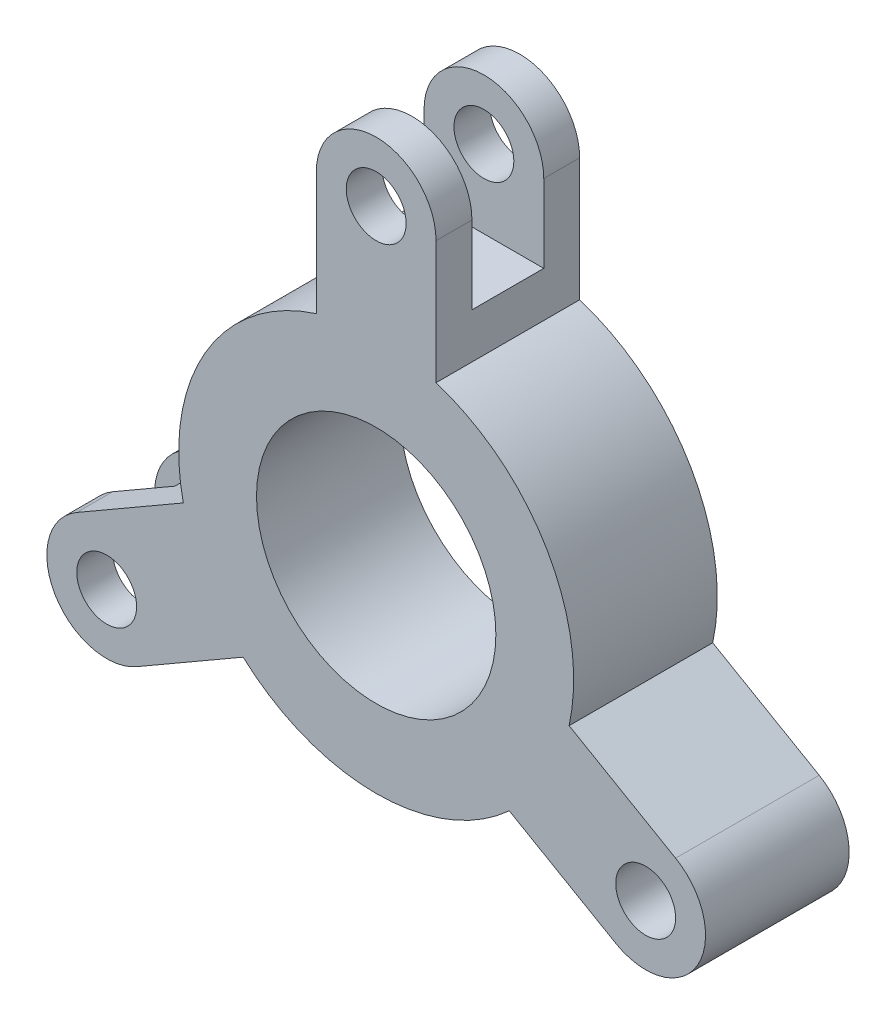
from build123d import *

# Parameters (mm, degrees)
EXTRUDE_1_DEPTH          = 6
EXTRUDE_1_DEPTH_BACK     = 6
SKETCH_1_R               = 2.5
CUT_EXTRUDE_1_DEPTH      = 3
CUT_EXTRUDE_1_DEPTH_BACK = 3
SKETCH_2_W               = 15
SKETCH_2_H               = 13
CUT_EXTRUDE_2_DEPTH      = 6


with BuildPart() as part:
    # Эскиз1 → Бобышка-Вытянуть1 (new, two sides: drawn at the far end of the back side and taken through both)
    # profile 1 of 9: a face of its own
    with BuildSketch(Plane.XY.offset(-EXTRUDE_1_DEPTH_BACK)):
        with BuildLine():
            Line((5, 15.724185194), (5, 8.660254038))
            ThreePointArc((5, 8.660254038), (8.660254038, 5), (10, 0))
            Line((10, 0), (16.117543831, -3.531965578))
            ThreePointArc((16.117543831, -3.531965578), (16.404107309, -1.776306108), (16.5, 0))
            ThreePointArc((16.5, 0), (13.318220602, 9.740379869), (5, 15.724185194))
        make_face()
    # profile 2 of 9: a face of its own
    with BuildSketch(Plane.XY.offset(-EXTRUDE_1_DEPTH_BACK)):
        with BuildLine():
            Line((-5, 15.724185194), (-5, 8.660254038))
            ThreePointArc((-5, 8.660254038), (0, 10), (5, 8.660254038))
            Line((5, 8.660254038), (5, 15.724185194))
            ThreePointArc((5, 15.724185194), (0, 16.5), (-5, 15.724185194))
        make_face()
    # profile 3 of 9: a face of its own
    with BuildSketch(Plane.XY.offset(-EXTRUDE_1_DEPTH_BACK)):
        with BuildLine():
            ThreePointArc((-10, 0), (-8.660254038, 5), (-5, 8.660254038))
            Line((-5, 8.660254038), (-5, 15.724185194))
            ThreePointArc((-5, 15.724185194), (-14.289419162, 8.25), (-16.117543831, -3.531965578))
            Line((-16.117543831, -3.531965578), (-10, 0))
        make_face()
    # profile 4 of 9: a face of its own
    with BuildSketch(Plane.XY.offset(-EXTRUDE_1_DEPTH_BACK)):
        with BuildLine():
            ThreePointArc((-5, -8.660254038), (-8.660254038, -5), (-10, 0))
            Line((-10, 0), (-16.117543831, -3.531965578))
            ThreePointArc((-16.117543831, -3.531965578), (-14.289419162, -8.25), (-11.117543831, -12.192219616))
            Line((-11.117543831, -12.192219616), (-5, -8.660254038))
        make_face()
    # profile 5 of 9: a face of its own
    with BuildSketch(Plane.XY.offset(-EXTRUDE_1_DEPTH_BACK)):
        with BuildLine():
            ThreePointArc((5, -8.660254038), (0, -10), (-5, -8.660254038))
            Line((-5, -8.660254038), (-11.117543831, -12.192219616))
            ThreePointArc((-11.117543831, -12.192219616), (0, -16.5), (11.117543831, -12.192219616))
            Line((11.117543831, -12.192219616), (5, -8.660254038))
        make_face()
    # profile 6 of 9: a face of its own
    with BuildSketch(Plane.XY.offset(-EXTRUDE_1_DEPTH_BACK)):
        with BuildLine():
            ThreePointArc((10, 0), (8.660254038, -5), (5, -8.660254038))
            Line((5, -8.660254038), (11.117543831, -12.192219616))
            ThreePointArc((11.117543831, -12.192219616), (14.289419162, -8.25), (16.117543831, -3.531965578))
            Line((16.117543831, -3.531965578), (10, 0))
        make_face()
    # profile 7 of 9: a face of its own
    with BuildSketch(Plane.XY.offset(-EXTRUDE_1_DEPTH_BACK)):
        with BuildLine():
            ThreePointArc((16.117543831, -3.531965578), (14.289419162, -8.25), (11.117543831, -12.192219616))
            Line((11.117543831, -12.192219616), (20.016660498, -17.330127019))
            ThreePointArc((20.016660498, -17.330127019), (26.846787517, -15.5), (25.016660498, -8.669872981))
            Line((25.016660498, -8.669872981), (16.117543831, -3.531965578))
        make_face()
        with Locations((22.516660498, -13)):
            Circle(SKETCH_1_R, mode=Mode.SUBTRACT)
    # profile 8 of 9: a face of its own
    with BuildSketch(Plane.XY.offset(-EXTRUDE_1_DEPTH_BACK)):
        with BuildLine():
            ThreePointArc((-11.117543831, -12.192219616), (-14.289419162, -8.25), (-16.117543831, -3.531965578))
            Line((-16.117543831, -3.531965578), (-25.016660498, -8.669872981))
            ThreePointArc((-25.016660498, -8.669872981), (-26.846787517, -15.5), (-20.016660498, -17.330127019))
            Line((-20.016660498, -17.330127019), (-11.117543831, -12.192219616))
        make_face()
        with Locations((-22.516660498, -13)):
            Circle(SKETCH_1_R, mode=Mode.SUBTRACT)
    # profile 9 of 9: a face of its own
    with BuildSketch(Plane.XY.offset(-EXTRUDE_1_DEPTH_BACK)):
        with BuildLine():
            Line((-5, 26), (-5, 15.724185194))
            ThreePointArc((-5, 15.724185194), (0, 16.5), (5, 15.724185194))
            Line((5, 15.724185194), (5, 26))
            ThreePointArc((5, 26), (0, 31), (-5, 26))
        make_face()
        with Locations((0, 26)):
            Circle(SKETCH_1_R, mode=Mode.SUBTRACT)
    extrude(amount=EXTRUDE_1_DEPTH + EXTRUDE_1_DEPTH_BACK)

    # Эскиз2 → Вырез-Вытянуть1 (cut, two sides: drawn at the far end of the back side and taken through both)
    with BuildSketch(Plane.XY.offset(-CUT_EXTRUDE_1_DEPTH_BACK)):
        with Locations((0, 26)):
            Rectangle(SKETCH_2_W, SKETCH_2_H)
    extrude(amount=CUT_EXTRUDE_1_DEPTH + CUT_EXTRUDE_1_DEPTH_BACK, mode=Mode.SUBTRACT)

    # Эскиз3 → Вырез-Вытянуть2 (cut)
    with BuildSketch(Plane.XY.offset(-3)):
        Polygon((-22.212812921, -25.526279442), (-11.820508076, -19.526279442), (-22.820508076, -0.473720558), (-33.212812921, -6.473720558), align=None)
    extrude(amount=CUT_EXTRUDE_2_DEPTH, mode=Mode.SUBTRACT)


solid = part.part
